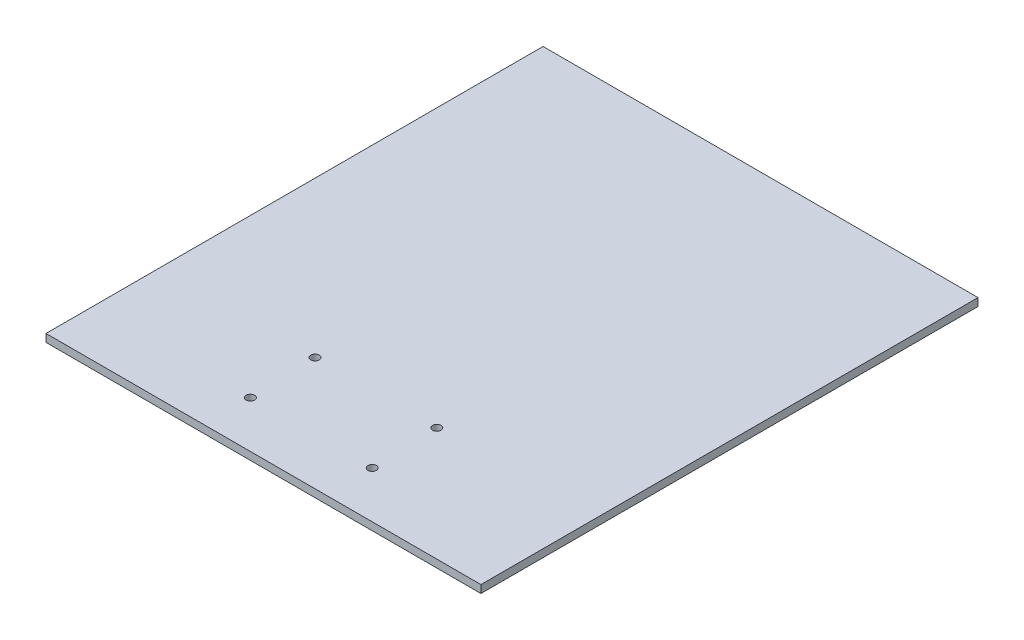
from build123d import *

# Parameters (mm, degrees)
SKETCH1_W                 = 177.8
SKETCH1_H                 = 203.2
BOSS_EXTRUDE1_DEPTH       = 3.175
TAP_DRILL_FOR_8_36_TAP1_D = 3.4544


with BuildPart() as part:
    # Sketch1 → Boss-Extrude1 (new body)
    with BuildSketch(Plane(origin=(0, 0, 0), x_dir=(1, 0, 0), z_dir=(0, 1, 0))):
        with Locations((-88.9, -101.6)):
            Rectangle(SKETCH1_W, SKETCH1_H)
    extrude(amount=BOSS_EXTRUDE1_DEPTH)

    # Tap Drill for #8-36 Tap1 (through all)
    with Locations(Plane(origin=(0, 3.175, 0), x_dir=(1, 0, 0), z_dir=(0, 1, 0))):
        with Locations((-114.3, -156.72712), (-64.511593905, -156.72712), (-113.288406095, -184.15), (-63.5, -184.15)):
            Hole(TAP_DRILL_FOR_8_36_TAP1_D / 2)


solid = part.part
